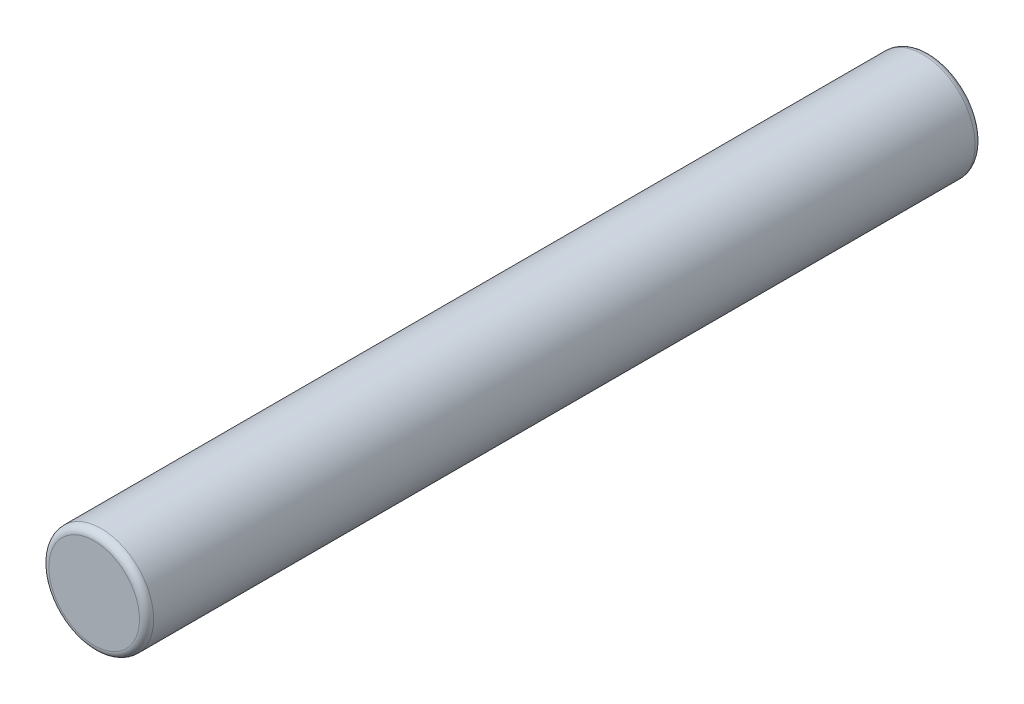
from build123d import *

# Parameters (mm, degrees)
CROQUIS2_R              = 3.7
SALIENTE_EXTRUIR1_DEPTH = 59
REDONDEO1_R             = 0.5


with BuildPart() as part:
    # Croquis2 → Saliente-Extruir1 (new body)
    with BuildSketch(Plane(origin=(0, 0, 0), x_dir=(0, 1, 0), z_dir=(0, 0, 1))):
        with Locations(Location((0, 0, 0), (0, 0, 270))):
            Circle(CROQUIS2_R)
    extrude(amount=SALIENTE_EXTRUIR1_DEPTH)

    # Redondeo1
    redondeo1_edges = [part.edges().sort_by_distance(p)[0] for p in [
        (-3.7, 0, 0),
        (-3.7, 0, 59),
    ]]
    fillet(redondeo1_edges, radius=REDONDEO1_R)


solid = part.part
